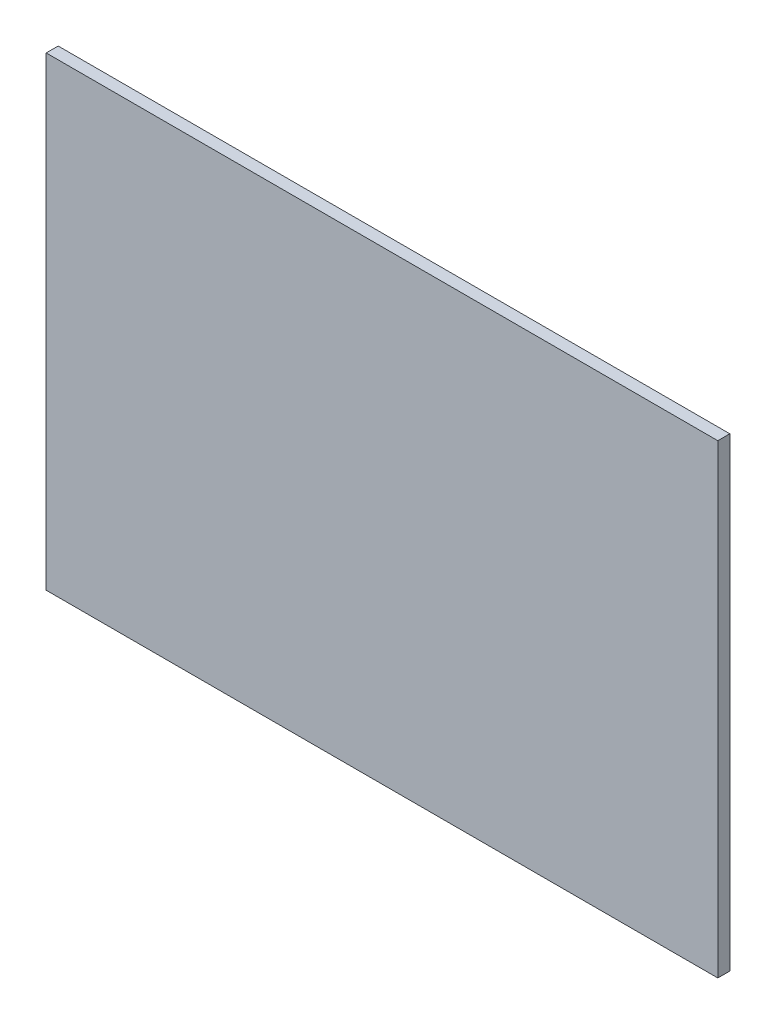
from build123d import *

# Parameters (mm, degrees)
SKETCH1_W           = 177.8
SKETCH1_H           = 123.19
BOSS_EXTRUDE1_DEPTH = 3.175


with BuildPart() as part:
    # Sketch1 → Boss-Extrude1 (new body)
    with BuildSketch(Plane.XY):
        with Locations((88.9, 61.595)):
            Rectangle(SKETCH1_W, SKETCH1_H)
    extrude(amount=BOSS_EXTRUDE1_DEPTH)


solid = part.part
